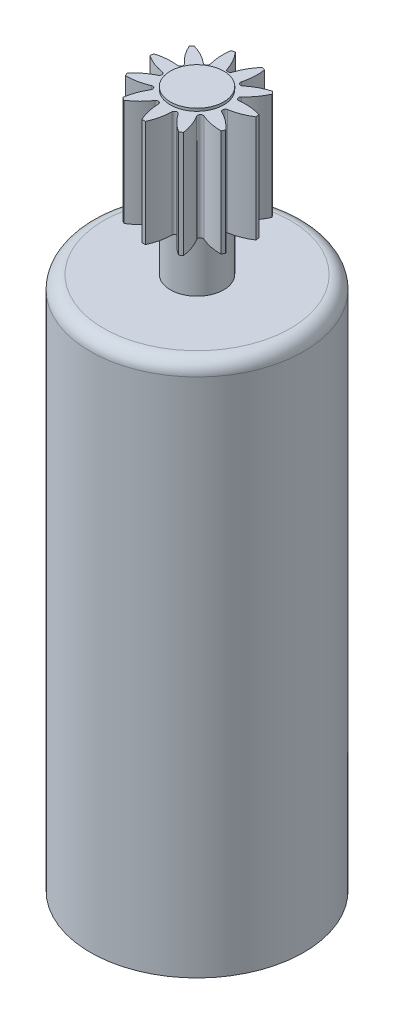
from build123d import *

# Parameters (mm, degrees)
CUT_EXTRUDE1_START = -5
CUT_EXTRUDE1_DEPTH = 5
CIRPATTERN1_COUNT  = 11


with BuildPart() as part:
    # Sketch1 → Revolve1 (revolve)
    with BuildSketch(Plane.XY, mode=Mode.PRIVATE) as revolve1_sk:
        with BuildLine():
            Line((0, 0), (0, 26.1))
            Line((0, 26.1), (1, 26.1))
            Line((1, 26.1), (1, 26))
            Line((1, 26), (2, 26))
            Line((2, 26), (2, 22))
            Line((2, 22), (1, 22))
            Line((1, 22), (1, 20))
            Line((1, 20), (3.5, 20))
            ThreePointArc((3.5, 20), (3.853553391, 19.853553391), (4, 19.5))
            Line((4, 19.5), (4, 0))
            Line((4, 0), (0, 0))
        make_face()
    revolve(revolve1_sk.sketch.rotate(Axis((0, 0, 0), (0, 1, 0)), 90), axis=Axis((0, 0, 0), (0, 1, 0)))

    # Sketch2 → Cut-Extrude1 (cut)
    with BuildSketch(Plane(origin=(0, 26, 0), x_dir=(1, 0, 0), z_dir=(0, 1, 0)).offset(CUT_EXTRUDE1_START)):
        with BuildLine():
            ThreePointArc((-0.5, 1.936491673), (0, 2), (0.5, 1.936491673))
            ThreePointArc((0.5, 1.936491673), (0.260400333, 1.599188187), (0.095331419, 1.219801979))
            ThreePointArc((0.095331419, 1.219801979), (0, 1.15), (-0.095331419, 1.219801979))
            ThreePointArc((-0.095331419, 1.219801979), (-0.260400333, 1.599188187), (-0.5, 1.936491673))
        make_face()
    cut_extrude1 = extrude(amount=CUT_EXTRUDE1_DEPTH, mode=Mode.SUBTRACT)

    # CirPattern1: Cut-Extrude1 ×11 about axis
    cirpattern1_axis = Axis((0, 0, 0), (0, 1, 0))
    for i in range(1, CIRPATTERN1_COUNT):
        add(cut_extrude1.rotate(cirpattern1_axis, i * 360 / CIRPATTERN1_COUNT), mode=Mode.SUBTRACT)


solid = part.part
